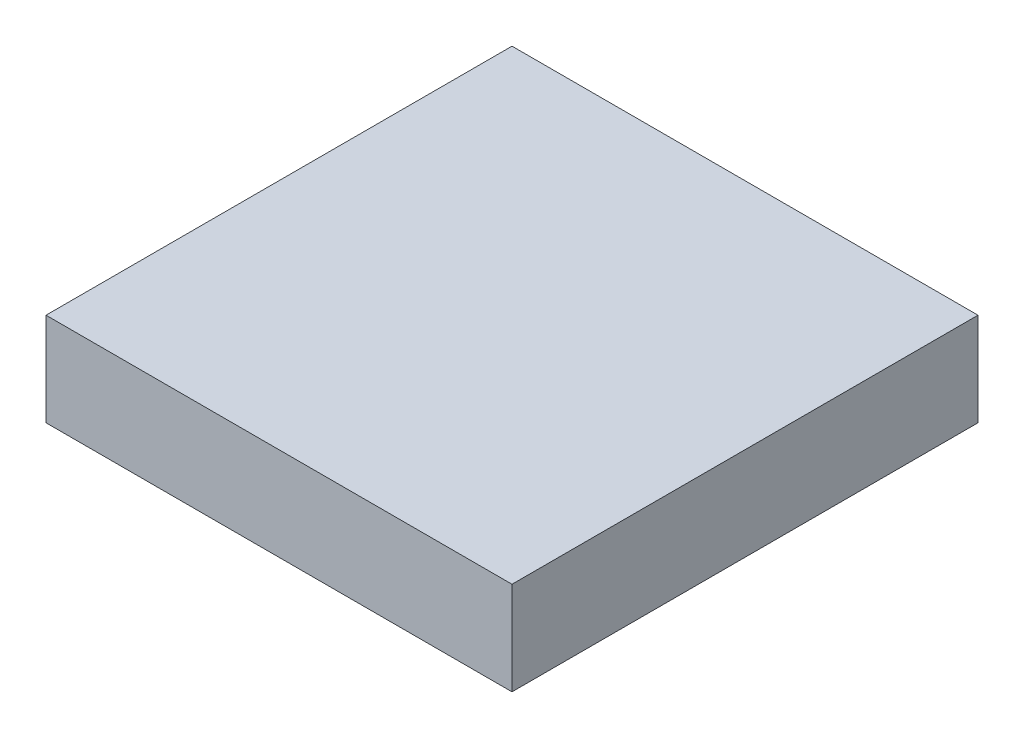
from build123d import *

# Parameters (mm, degrees)
SKICA1_W                = 10
SKICA1_H                = 10
P_IDAT_VYSUNUT_M1_DEPTH = 2


with BuildPart() as part:
    # Skica1 → Přidat vysunutím1 (new body)
    with BuildSketch(Plane(origin=(0, 0, 0), x_dir=(1, 0, 0), z_dir=(0, 1, 0))):
        Rectangle(SKICA1_W, SKICA1_H)
    extrude(amount=P_IDAT_VYSUNUT_M1_DEPTH)


solid = part.part
